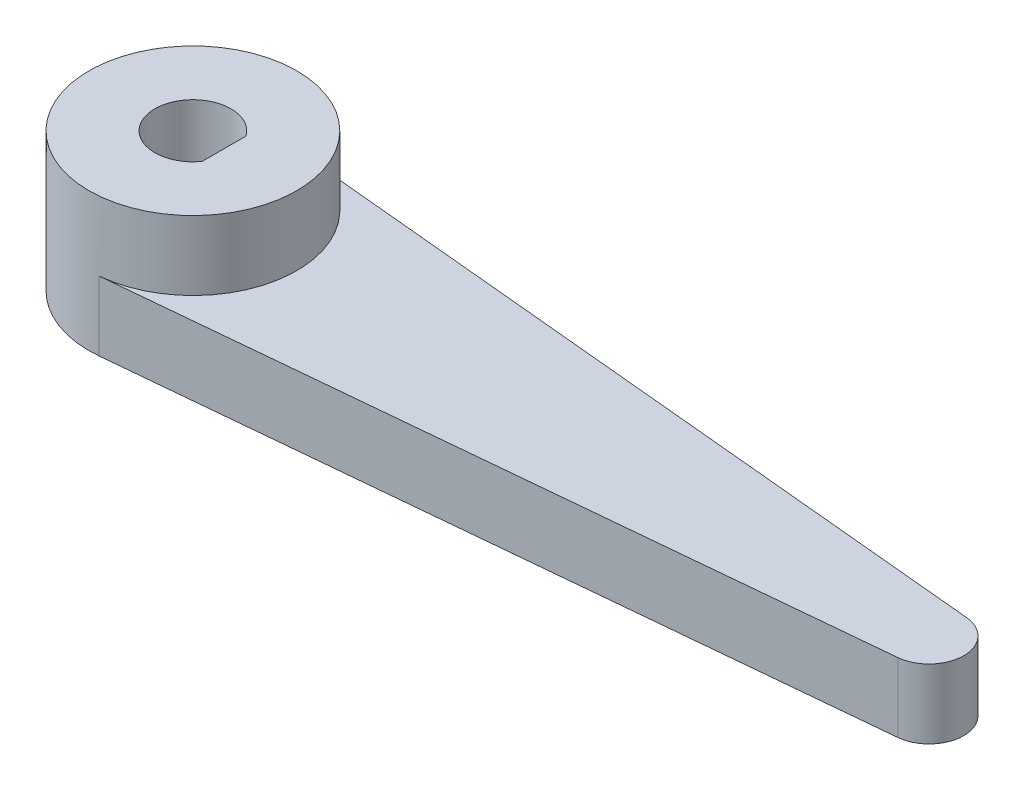
from build123d import *
from build123d.topology import SkipClean

# Parameters (mm, degrees)
EXTRUDE_1_DEPTH     = 5
SKETCH_2_R          = 7.5
EXTRUDE_2_DEPTH     = 5
CUT_EXTRUDE_1_DEPTH = 58.031822398


with BuildPart() as part:
    # 草图1 → 凸台-拉伸1 (new body)
    with BuildSketch(Plane(origin=(0, 0, 0), x_dir=(1, 0, 0), z_dir=(0, 1, 0))):
        with BuildLine():
            Line((0.705615189, 7.466733369), (53.380319548, 2.488911123))
            ThreePointArc((53.380319548, 2.488911123), (55.645114485, 0), (53.380319548, -2.488911123))
            Line((53.380319548, -2.488911123), (0.705615189, -7.466733369))
            ThreePointArc((0.705615189, -7.466733369), (-7.5, 0), (0.705615189, 7.466733369))
        make_face()
    extrude(amount=EXTRUDE_1_DEPTH)

    # 草图2 → 凸台-拉伸2 (add)
    with SkipClean():  # the faces are left unmerged after this step: merging them gives an invalid solid
        with BuildSketch(Plane(origin=(0, 5, 0), x_dir=(1, 0, 0), z_dir=(0, 1, 0))):
            with Locations(Location((0, 0, 0), (0, 0, 84.601512911))):
                Circle(SKETCH_2_R)
        extrude(amount=EXTRUDE_2_DEPTH)

    # 草图3 → 切除-拉伸1 (cut, through all)
    with SkipClean():  # the faces are left unmerged after this step: merging them gives an invalid solid
        with BuildSketch(Plane(origin=(0, 10, 0), x_dir=(1, 0, 0), z_dir=(0, 1, 0))):
            with BuildLine():
                Line((2.25, 1.58113883), (2.25, -1.58113883))
                ThreePointArc((2.25, -1.58113883), (-2.75, 0), (2.25, 1.58113883))
            make_face()
        extrude(amount=-CUT_EXTRUDE_1_DEPTH, mode=Mode.SUBTRACT)


solid = part.part
